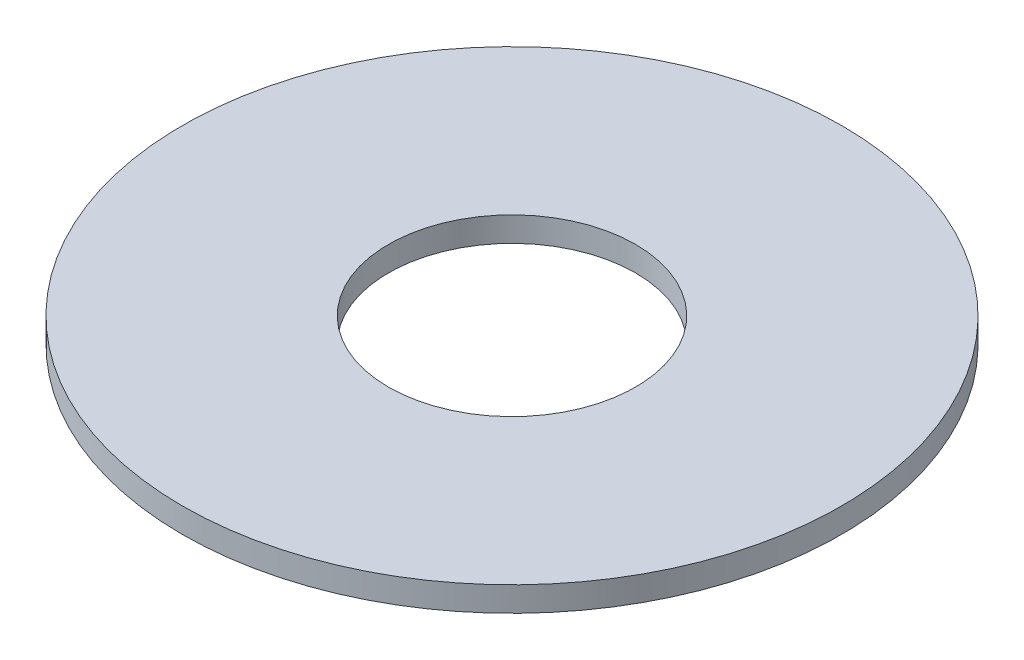
from build123d import *

# Parameters (mm, degrees)
CROQUIS1_R              = 4
CROQUIS1_R_2            = 1.5
SALIENTE_EXTRUIR1_DEPTH = 0.3


with BuildPart() as part:
    # Croquis1 → Saliente-Extruir1 (new body)
    with BuildSketch(Plane(origin=(0, 0, 0), x_dir=(1, 0, 0), z_dir=(0, 1, 0))):
        with Locations(Location((0, 0, 0), (0, 0, 270))):
            Circle(CROQUIS1_R)
        with Locations(Location((0, 0, 0), (0, 0, 270))):
            Circle(CROQUIS1_R_2, mode=Mode.SUBTRACT)
    extrude(amount=SALIENTE_EXTRUIR1_DEPTH)


solid = part.part
